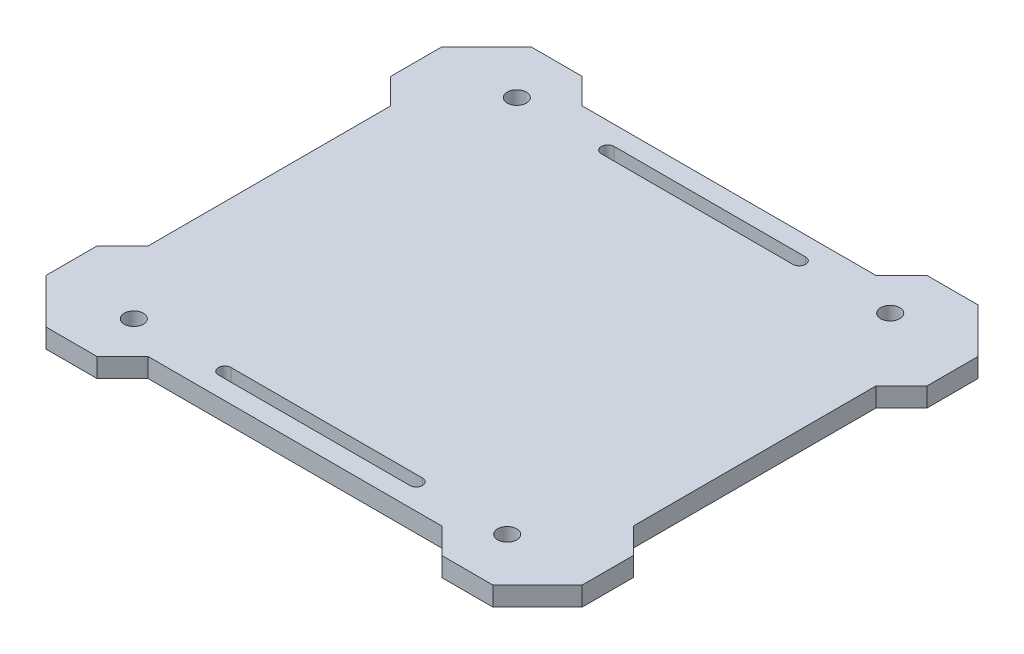
from build123d import *

# Parameters (mm, degrees)
BOSS_EXTRUDE1_DEPTH = 3
SKETCH8_R           = 1.5
CUT_EXTRUDE5_DEPTH  = 57.71860365
CUT_EXTRUDE6_DEPTH  = 10


with BuildPart() as part:
    # Sketch1 → Boss-Extrude1 (new body)
    with BuildSketch(Plane(origin=(0, 0, 0), x_dir=(1, 0, 0), z_dir=(0, 1, 0))):
        Polygon((-23, 34), (23, 34), (27, 38), (35, 38), (42, 31), (42, 23), (38, 19), (38, -19), (42, -23), (42, -31), (35, -38), (27, -38), (23, -34), (-23, -34), (-27, -38), (-35, -38), (-42, -31), (-42, -23), (-38, -19), (-38, 19), (-42, 23), (-42, 31), (-35, 38), (-27, 38), align=None)
    extrude(amount=-BOSS_EXTRUDE1_DEPTH)

    # Sketch8 → Cut-Extrude5 (cut, through all)
    with BuildSketch(Plane.XZ.offset(3)):
        with Locations(Location((-29.25, -30, 0), (0, 0, 270))):
            Circle(SKETCH8_R)
        with Locations(Location((29.25, -30, 0), (0, 0, 90))):
            Circle(SKETCH8_R)
        with Locations(Location((29.25, 30, 0), (0, 0, 270))):
            Circle(SKETCH8_R)
        with Locations(Location((-29.25, 30, 0), (0, 0, 90))):
            Circle(SKETCH8_R)
    extrude(amount=-CUT_EXTRUDE5_DEPTH, mode=Mode.SUBTRACT)

    # Sketch11 → Cut-Extrude6 (cut)
    with BuildSketch(Plane.XZ.offset(3)):
        with BuildLine():
            Line((-15, -31), (15, -31))
            ThreePointArc((15, -31), (16, -30), (15, -29))
            Line((15, -29), (-15, -29))
            ThreePointArc((-15, -29), (-16, -30), (-15, -31))
        make_face()
        with BuildLine():
            Line((-15, 31), (15, 31))
            ThreePointArc((15, 31), (16, 30), (15, 29))
            Line((15, 29), (-15, 29))
            ThreePointArc((-15, 29), (-16, 30), (-15, 31))
        make_face()
    extrude(amount=-CUT_EXTRUDE6_DEPTH, mode=Mode.SUBTRACT)


solid = part.part
